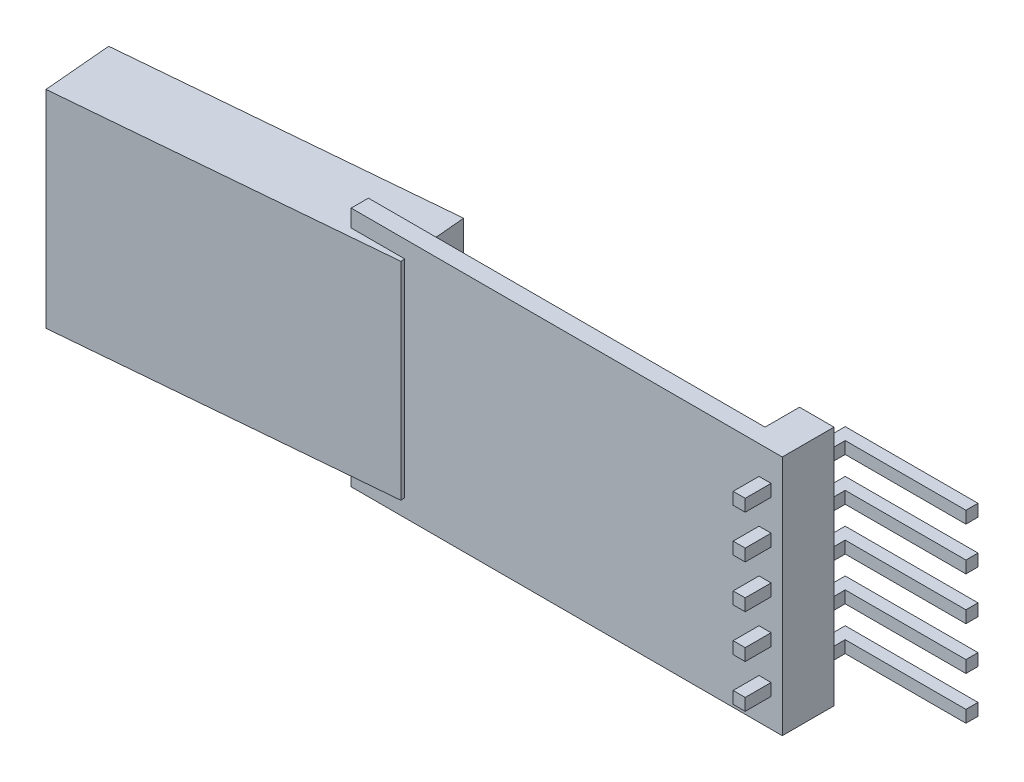
from build123d import *

# Parameters (mm, degrees)
SKETCH_1_W      = 25
SKETCH_1_H      = 14
EXTRUDE_1_DEPTH = 1
SKETCH_1_3_W    = 2
SKETCH_1_3_H    = 14
SKETCH_1_3_W_2  = 0.7
SKETCH_1_3_H_2  = 0.7
EXTRUDE_2_DEPTH = 2
SKETCH_1_4_W    = 0.7
SKETCH_1_4_H    = 0.7
EXTRUDE_3_DEPTH = 2.5
SKETCH_1_5_W    = 0.7
SKETCH_1_5_H    = 0.7
EXTRUDE_4_DEPTH = 4
SKETCH_2_W      = 0.7
SKETCH_2_H      = 0.7
EXTRUDE_5_DEPTH = 7
SKETCH_4_W      = 19
SKETCH_4_H      = 12
EXTRUDE_6_DEPTH = 2.5
SKETCH_4_2_W    = 19
SKETCH_4_2_H    = 12
EXTRUDE_7_DEPTH = 1.5


with BuildPart() as part:
    # Эскиз1 → Бобышка-Вытянуть1 (new body)
    with BuildSketch(Plane.XY):
        with Locations((-12.5, 7)):
            Rectangle(SKETCH_1_W, SKETCH_1_H)
    extrude(amount=EXTRUDE_1_DEPTH)

    # Эскиз1<3> → Бобышка-Вытянуть2 (add)
    with BuildSketch(Plane.XY):
        with Locations((-1, 7)):
            Rectangle(SKETCH_1_3_W, SKETCH_1_3_H)
        with Locations((-1, 2)):
            Rectangle(SKETCH_1_3_W_2, SKETCH_1_3_H_2, mode=Mode.SUBTRACT)
        with Locations((-1, 4.5)):
            Rectangle(SKETCH_1_3_W_2, SKETCH_1_3_H_2, mode=Mode.SUBTRACT)
        with Locations((-1, 7)):
            Rectangle(SKETCH_1_3_W_2, SKETCH_1_3_H_2, mode=Mode.SUBTRACT)
        with Locations((-1, 9.5)):
            Rectangle(SKETCH_1_3_W_2, SKETCH_1_3_H_2, mode=Mode.SUBTRACT)
        with Locations((-1, 12)):
            Rectangle(SKETCH_1_3_W_2, SKETCH_1_3_H_2, mode=Mode.SUBTRACT)
    extrude(amount=-EXTRUDE_2_DEPTH)

    # Эскиз1<4> → Бобышка-Вытянуть3 (add)
    with BuildSketch(Plane.XY):
        with Locations((-1, 4.5)):
            Rectangle(SKETCH_1_4_W, SKETCH_1_4_H)
        with Locations((-1, 2)):
            Rectangle(SKETCH_1_4_W, SKETCH_1_4_H)
        with Locations((-1, 7)):
            Rectangle(SKETCH_1_4_W, SKETCH_1_4_H)
        with Locations((-1, 9.5)):
            Rectangle(SKETCH_1_4_W, SKETCH_1_4_H)
        with Locations((-1, 12)):
            Rectangle(SKETCH_1_4_W, SKETCH_1_4_H)
    extrude(amount=EXTRUDE_3_DEPTH)

    # Эскиз1<5> → Бобышка-Вытянуть4 (add)
    with BuildSketch(Plane.XY):
        with Locations((-1, 4.5)):
            Rectangle(SKETCH_1_5_W, SKETCH_1_5_H)
        with Locations((-1, 2)):
            Rectangle(SKETCH_1_5_W, SKETCH_1_5_H)
        with Locations((-1, 7)):
            Rectangle(SKETCH_1_5_W, SKETCH_1_5_H)
        with Locations((-1, 9.5)):
            Rectangle(SKETCH_1_5_W, SKETCH_1_5_H)
        with Locations((-1, 12)):
            Rectangle(SKETCH_1_5_W, SKETCH_1_5_H)
    extrude(amount=-EXTRUDE_4_DEPTH)

    # Эскиз2 → Бобышка-Вытянуть5 (add)
    with BuildSketch(Plane(origin=(-0.65, 0, 0), x_dir=(0, 0, -1), z_dir=(1, 0, 0))):
        with Locations((3.65, 12)):
            Rectangle(SKETCH_2_W, SKETCH_2_H)
        with Locations((3.65, 9.5)):
            Rectangle(SKETCH_2_W, SKETCH_2_H)
        with Locations((3.65, 7)):
            Rectangle(SKETCH_2_W, SKETCH_2_H)
        with Locations((3.65, 4.5)):
            Rectangle(SKETCH_2_W, SKETCH_2_H)
        with Locations((3.65, 2)):
            Rectangle(SKETCH_2_W, SKETCH_2_H)
    extrude(amount=EXTRUDE_5_DEPTH)



with BuildPart() as body_2:
    # Эскиз4 → Бобышка-Вытянуть6 (new body)
    with BuildSketch(Plane(origin=(-0.189903087, 0, -2.170602221), x_dir=(-0.9961946980917455, 0, 0.08715574274765837), z_dir=(-0.08715574274765839, 0, -0.9961946980917457))):
        with Locations((31.404867452, 7)):
            Rectangle(SKETCH_4_W, SKETCH_4_H)
    extrude(amount=EXTRUDE_6_DEPTH)


with BuildPart() as part_1:
    add(part.part)

    add(body_2.part)  # Бобышка-Вытянуть7 merges body 2
    # Эскиз4<2> → Бобышка-Вытянуть7 (add)
    with BuildSketch(Plane(origin=(-0.189903087, 0, -2.170602221), x_dir=(-0.9961946980917455, 0, 0.08715574274765837), z_dir=(-0.08715574274765839, 0, -0.9961946980917457))):
        with Locations((31.404867452, 7)):
            Rectangle(SKETCH_4_2_W, SKETCH_4_2_H)
    extrude(amount=-EXTRUDE_7_DEPTH)


solid = part_1.part
